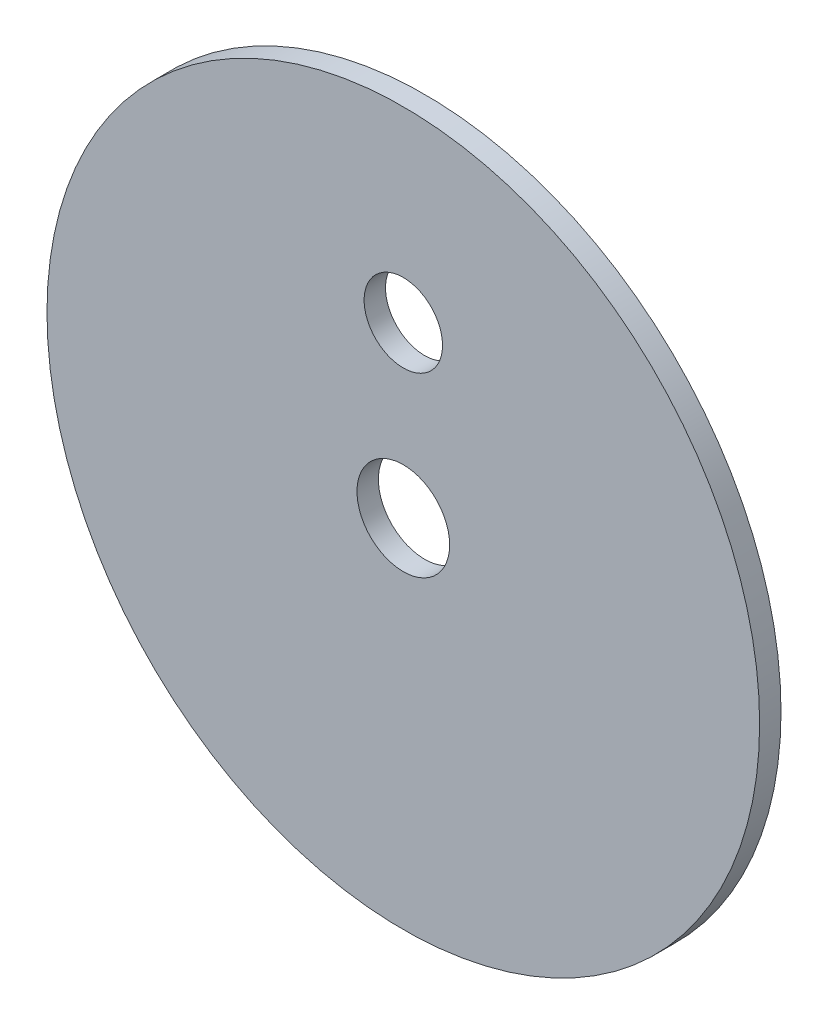
from build123d import *

# Parameters (mm, degrees)
SKIZZE1_R                            = 50
AUFSATZ_LINEAR_AUSTRAGEN1_DEPTH      = 3
SCHNITT_LINEAR_AUSTRAGEN1_DEPTH      = 71.774289117
SCHNITT_LINEAR_AUSTRAGEN1_DEPTH_BACK = 71.774289117
SKIZZE2_R                            = 6.5
SKIZZE2_R_2                          = 5.5


with BuildPart() as part:
    # Skizze1 → Aufsatz-Linear austragen1 (new body)
    with BuildSketch(Plane.XY):
        Circle(SKIZZE1_R)
    extrude(amount=AUFSATZ_LINEAR_AUSTRAGEN1_DEPTH)

    # Skizze2 → Schnitt-Linear austragen1 (cut, two sides: drawn at the far end of the back side and taken through both)
    with BuildSketch(Plane.XY.offset(3).offset(-SCHNITT_LINEAR_AUSTRAGEN1_DEPTH_BACK)):
        Circle(SKIZZE2_R)
        with Locations((0, 23.75)):
            Circle(SKIZZE2_R_2)
    extrude(amount=SCHNITT_LINEAR_AUSTRAGEN1_DEPTH + SCHNITT_LINEAR_AUSTRAGEN1_DEPTH_BACK, mode=Mode.SUBTRACT)


solid = part.part
